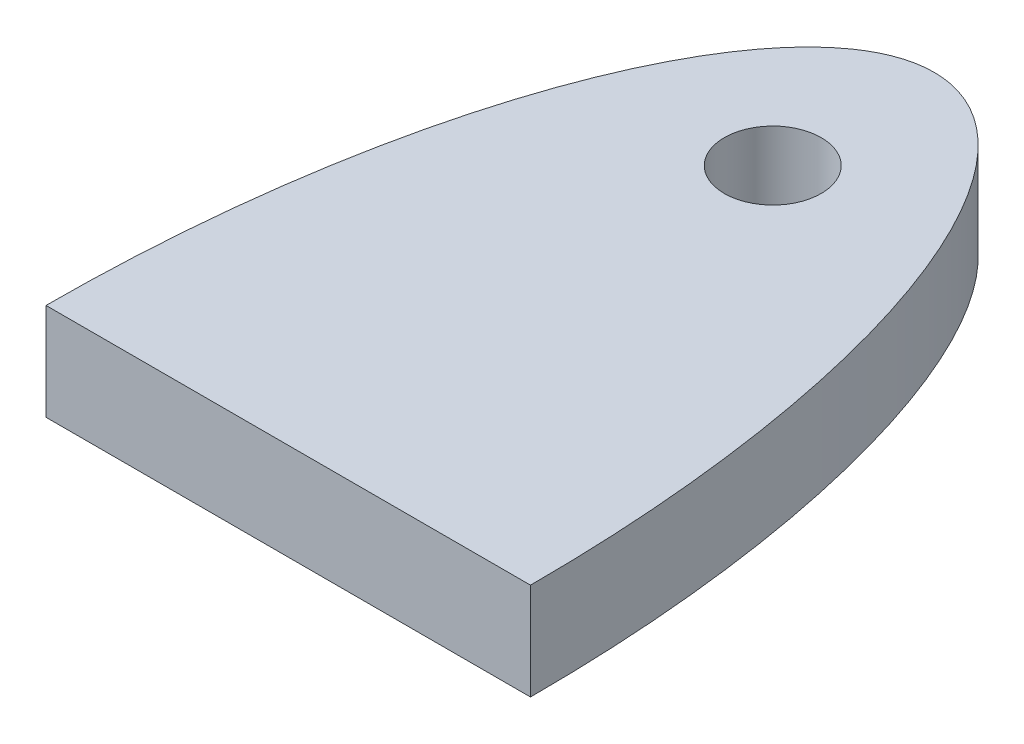
from build123d import *

# Parameters (mm, degrees)
BOSS_EXTRUDE1_DEPTH = 3
SKETCH2_R           = 1.5
CUT_EXTRUDE1_DEPTH  = 3


with BuildPart() as part:
    # Sketch1 → Boss-Extrude1 (new body)
    with BuildSketch(Plane(origin=(0, 0, 0), x_dir=(1, 0, 0), z_dir=(0, 1, 0))):
        with BuildLine():
            Line((0, 0), (15, 0))
            add(Edge.make_bspline(
                [(15, 0), (15, 20), (7.5, 20), (0, 20), (0, 0)],
                knots=[4.71238898, 4.71238898, 4.71238898, 6.283185307, 6.283185307, 7.853981634, 7.853981634, 7.853981634], degree=2, weights=[1, 0.707106781, 1, 0.707106781, 1]))
        make_face()
    extrude(amount=BOSS_EXTRUDE1_DEPTH)

    # Sketch2 → Cut-Extrude1 (cut)
    with BuildSketch(Plane(origin=(0, 3, 0), x_dir=(1, 0, 0), z_dir=(0, 1, 0))):
        with Locations(Location((7.5, 15, 0), (0, 0, 270))):
            Circle(SKETCH2_R)
    extrude(amount=-CUT_EXTRUDE1_DEPTH, mode=Mode.SUBTRACT)


solid = part.part
